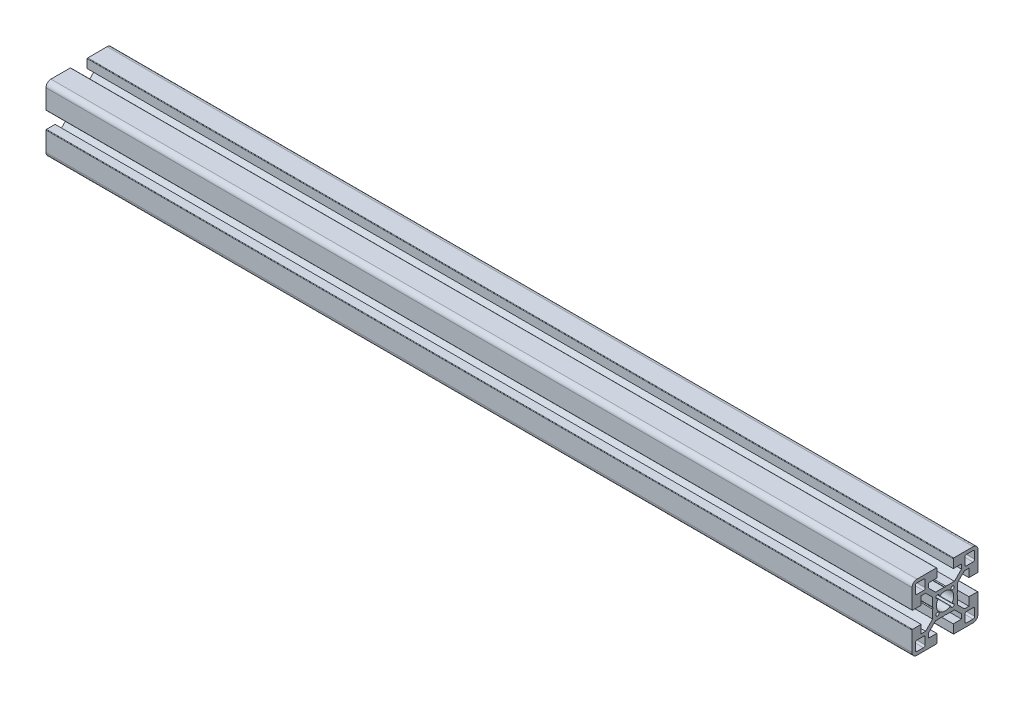
from build123d import *

# Parameters (mm, degrees)
STRUCTURAL_MEMBER2_DEPTH = 525


with BuildPart() as part:
    # Profile → Structural Member2 (new body)
    with BuildSketch(Plane(origin=(0, 0, 0), x_dir=(0, 0, -1), z_dir=(1, 0, 0))):
        with BuildLine():
            Line((69.699997, 55), (64.5, 55))
            Line((64.5, 55), (64.5, 60))
            Line((64.5, 60), (61.767777, 60))
            Line((61.767777, 60), (57.5, 55.732231))
            Line((57.5, 55.732231), (57.5, 50.519615242))
            Line((57.5, 50.519615242), (57.2, 50))
            Line((57.2, 50), (57.5, 49.480384758))
            Line((57.5, 49.480384758), (57.5, 44.26777))
            Line((57.5, 44.26777), (61.767777, 39.999999))
            Line((61.767777, 39.999999), (64.5, 40))
            Line((64.5, 40), (64.5, 45))
            Line((64.5, 45), (69.699997, 45))
            ThreePointArc((69.699997, 45), (69.912132034, 44.912132034), (70, 44.699997))
            Line((70, 44.699997), (70, 33))
            ThreePointArc((70, 33), (69.121320344, 30.878679656), (67, 30))
            Line((67, 30), (55.3, 30))
            ThreePointArc((55.3, 30), (55.087867966, 30.087867966), (55, 30.3))
            Line((55, 30.3), (55, 35.5))
            Line((55, 35.5), (60, 35.5))
            Line((60, 35.5), (60.000008, 38.232225))
            Line((60.000008, 38.232225), (55.732238, 42.5))
            Line((55.732238, 42.5), (50.519615242, 42.5))
            Line((50.519615242, 42.5), (50, 42.8))
            Line((50, 42.8), (49.480384758, 42.5))
            Line((49.480384758, 42.5), (44.26777, 42.5))
            Line((44.26777, 42.5), (40, 38.23223))
            Line((40, 38.23223), (40, 35.5))
            Line((40, 35.5), (45, 35.5))
            Line((45, 35.5), (45, 30.3))
            ThreePointArc((45, 30.3), (44.912130974, 30.087866905), (44.699997, 30))
            Line((44.699997, 30), (33, 30))
            ThreePointArc((33, 30), (30.878679656, 30.878679656), (30, 33))
            Line((30, 33), (30, 44.699997))
            ThreePointArc((30, 44.699997), (30.087867966, 44.912132034), (30.300003, 45))
            Line((30.300003, 45), (35.5, 45))
            Line((35.5, 45), (35.5, 40.000006))
            Line((35.5, 40.000006), (38.232224, 40.000006))
            Line((38.232224, 40.000006), (42.5, 44.267753))
            Line((42.5, 44.267753), (42.5, 49.480384758))
            Line((42.5, 49.480384758), (42.8, 50))
            Line((42.8, 50), (42.5, 50.519615242))
            Line((42.5, 50.519615242), (42.5, 55.732248))
            Line((42.5, 55.732248), (38.232231, 60.000001))
            Line((38.232231, 60.000001), (35.5, 60))
            Line((35.5, 60), (35.5, 55))
            Line((35.5, 55), (30.300003, 55))
            ThreePointArc((30.300003, 55), (30.087867966, 55.087867966), (30, 55.300003))
            Line((30, 55.300003), (30, 67.000001))
            ThreePointArc((30, 67.000001), (30.87868001, 69.121320697), (33, 70))
            Line((33, 70), (44.699997, 70))
            ThreePointArc((44.699997, 70), (44.912130974, 69.912133095), (45, 69.7))
            Line((45, 69.7), (45, 64.5))
            Line((45, 64.5), (40, 64.5))
            Line((40, 64.5), (40, 61.767771))
            Line((40, 61.767771), (44.267771, 57.5))
            Line((44.267771, 57.5), (49.480384758, 57.5))
            Line((49.480384758, 57.5), (50, 57.2))
            Line((50, 57.2), (50.519615242, 57.5))
            Line((50.519615242, 57.5), (55.732237, 57.5))
            Line((55.732237, 57.5), (60.000008, 61.767771))
            Line((60.000008, 61.767771), (60, 64.5))
            Line((60, 64.5), (55, 64.5))
            Line((55, 64.5), (55, 69.7))
            ThreePointArc((55, 69.7), (55.087867966, 69.912132034), (55.3, 70))
            Line((55.3, 70), (67, 70))
            ThreePointArc((67, 70), (69.12131999, 69.121320697), (70, 67.000001))
            Line((70, 67.000001), (70, 55.300003))
            ThreePointArc((70, 55.300003), (69.912132034, 55.087867966), (69.699997, 55))
        make_face()
        with BuildLine():
            Line((37, 68), (33, 68))
            ThreePointArc((33, 68), (32.292893219, 67.707106781), (32, 67))
            Line((32, 67), (32, 63))
            ThreePointArc((32, 63), (32.292893219, 62.292893219), (33, 62))
            Line((33, 62), (37, 62))
            ThreePointArc((37, 62), (37.707106781, 62.292893219), (38, 63))
            Line((38, 63), (38, 67))
            ThreePointArc((38, 67), (37.707106781, 67.707106781), (37, 68))
        make_face(mode=Mode.SUBTRACT)
        with BuildLine():
            Line((68, 67), (68, 63))
            ThreePointArc((68, 63), (67.707106781, 62.292893219), (67, 62))
            Line((67, 62), (62.999985, 62))
            ThreePointArc((62.999985, 62), (62.29288933, 62.292897108), (62, 62.999996))
            Line((62, 62.999996), (62, 67))
            ThreePointArc((62, 67), (62.292893219, 67.707106781), (63, 68))
            Line((63, 68), (67, 68))
            ThreePointArc((67, 68), (67.707106781, 67.707106781), (68, 67))
        make_face(mode=Mode.SUBTRACT)
        with BuildLine():
            Line((68, 33), (68, 37.000001))
            ThreePointArc((68, 37.000001), (67.707106781, 37.707107781), (67, 38.000001))
            Line((67, 38.000001), (63, 38.000001))
            ThreePointArc((63, 38.000001), (62.292893219, 37.707107781), (62, 37.000001))
            Line((62, 37.000001), (62, 33))
            ThreePointArc((62, 33), (62.292893219, 32.292893219), (63, 32))
            Line((63, 32), (67, 32))
            ThreePointArc((67, 32), (67.707106781, 32.292893219), (68, 33))
        make_face(mode=Mode.SUBTRACT)
        with BuildLine():
            Line((33, 38), (37.000015, 38))
            ThreePointArc((37.000015, 38), (37.707114206, 37.707099357), (38, 36.999994))
            Line((38, 36.999994), (38, 33))
            ThreePointArc((38, 33), (37.707106781, 32.292893219), (37, 32))
            Line((37, 32), (33, 32))
            ThreePointArc((33, 32), (32.292893219, 32.292893219), (32, 33))
            Line((32, 33), (32, 37))
            ThreePointArc((32, 37), (32.292893219, 37.707106781), (33, 38))
        make_face(mode=Mode.SUBTRACT)
        with BuildLine():
            ThreePointArc((45.693983688, 53.003451934), (44.75, 50.000006422), (45.69397634, 46.996558601))
            ThreePointArc((45.69397634, 46.996558601), (45.717617411, 46.612262817), (45.393937878, 46.403759319))
            ThreePointArc((45.393937878, 46.403759319), (44.696798004, 44.696601447), (46.403759064, 45.394223081))
            ThreePointArc((46.403759064, 45.394223081), (46.613183993, 45.71810041), (46.998050321, 45.692936253))
            ThreePointArc((46.998050321, 45.692936253), (50.001173377, 44.750000131), (53.00387464, 45.694278557))
            ThreePointArc((53.00387464, 45.694278557), (53.38786573, 45.717565842), (53.596237266, 45.39418873))
            ThreePointArc((53.596237266, 45.39418873), (55.303208824, 44.696612273), (54.60606185, 46.403759282))
            ThreePointArc((54.60606185, 46.403759282), (54.2823423, 46.612342937), (54.306127195, 46.996707043))
            ThreePointArc((54.306127195, 46.996707043), (55.25, 50.000037648), (54.306084121, 53.003354715))
            ThreePointArc((54.306084121, 53.003354715), (54.28277906, 53.388519532), (54.607953771, 53.596260884))
            ThreePointArc((54.607953771, 53.596260884), (55.30278657, 55.303809323), (53.596244226, 54.606509157))
            ThreePointArc((53.596244226, 54.606509157), (53.387865247, 54.28245073), (53.003318835, 54.306109146))
            ThreePointArc((53.003318835, 54.306109146), (50.000075464, 55.249999999), (46.996804959, 54.306195484))
            ThreePointArc((46.996804959, 54.306195484), (46.612495539, 54.2822647), (46.403758539, 54.605831196))
            ThreePointArc((46.403758539, 54.605831196), (44.696618996, 55.30321925), (45.394389581, 53.596236026))
            ThreePointArc((45.394389581, 53.596236026), (45.717718991, 53.387547534), (45.693983688, 53.003451934))
        make_face(mode=Mode.SUBTRACT)
    extrude(amount=STRUCTURAL_MEMBER2_DEPTH)


solid = part.part
